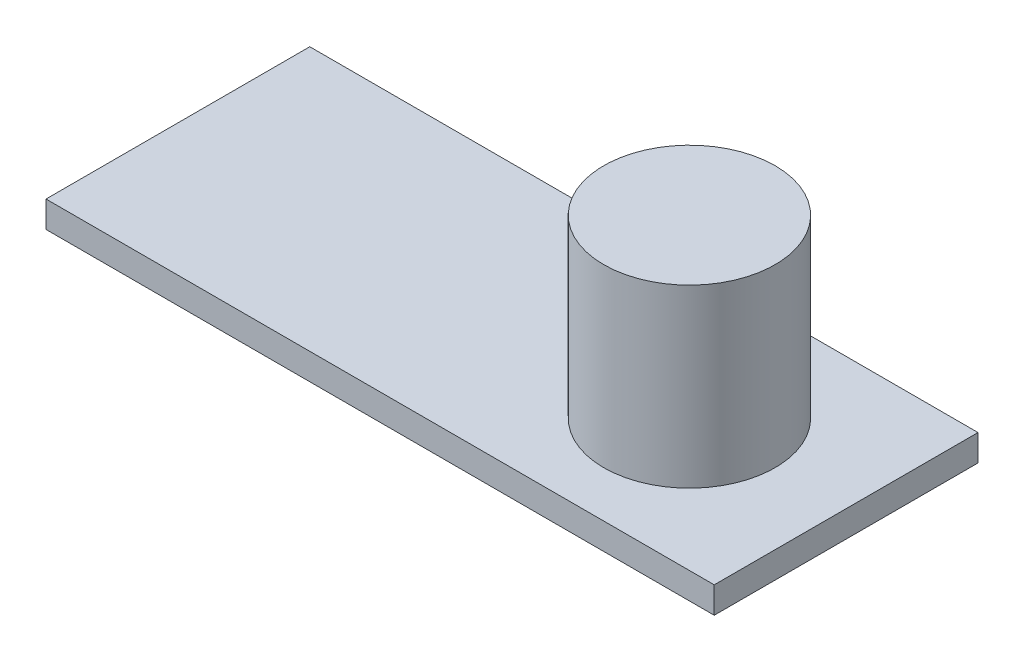
from build123d import *

# Parameters (mm, degrees)
SKETCH1_W           = 38
SKETCH1_H           = 15
BOSS_EXTRUDE1_DEPTH = 1.5
SKETCH1_3_R         = 4.875
BOSS_EXTRUDE2_DEPTH = 10


with BuildPart() as part:
    # Sketch1 → Boss-Extrude1 (new body)
    with BuildSketch(Plane(origin=(0, 0, 0), x_dir=(1, 0, 0), z_dir=(0, 1, 0))):
        Rectangle(SKETCH1_W, SKETCH1_H)
    extrude(amount=-BOSS_EXTRUDE1_DEPTH)

    # Sketch1<3> → Boss-Extrude2 (add)
    with BuildSketch(Plane(origin=(0, 0, 0), x_dir=(1, 0, 0), z_dir=(0, 1, 0))):
        with Locations((10.09, 0)):
            Circle(SKETCH1_3_R)
    extrude(amount=BOSS_EXTRUDE2_DEPTH)


solid = part.part
